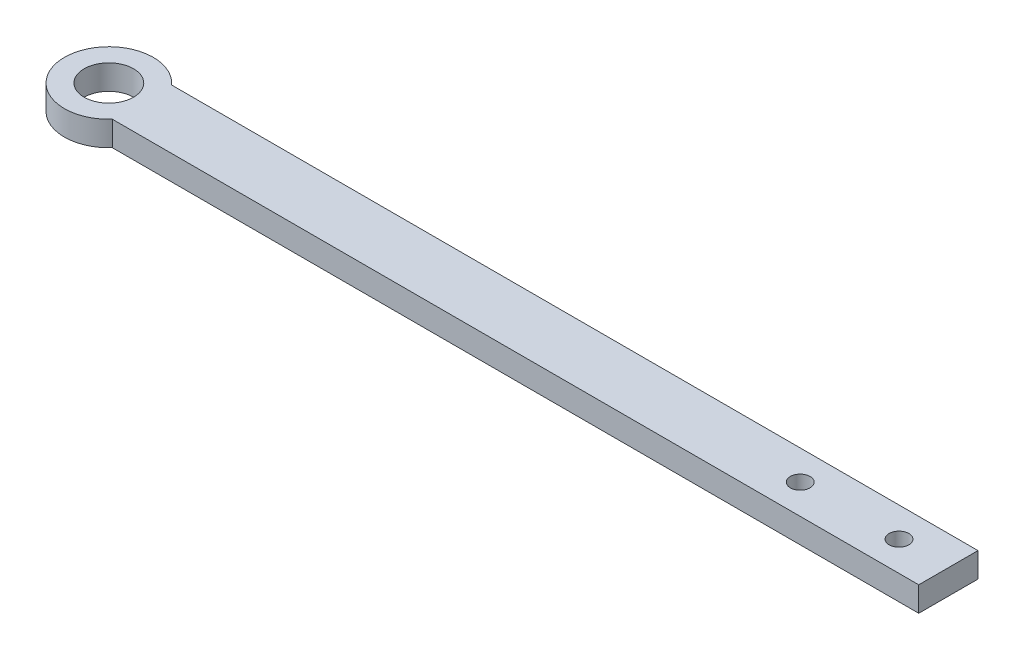
from build123d import *

# Parameters (mm, degrees)
BOSS_EXTRUDE1_DEPTH = 5
SKETCH2_R           = 5
SKETCH2_R_2         = 2
CUT_EXTRUDE1_DEPTH  = 171.311479355


with BuildPart() as part:
    # Sketch1 → Boss-Extrude1 (new body)
    with BuildSketch(Plane(origin=(0, 0, 0), x_dir=(1, 0, 0), z_dir=(0, 1, 0))):
        with BuildLine():
            Line((6.708203932, 6), (170, 6))
            Line((170, 6), (170, -6))
            Line((170, -6), (6.708203932, -6))
            ThreePointArc((6.708203932, -6), (-9, 0), (6.708203932, 6))
        make_face()
    extrude(amount=BOSS_EXTRUDE1_DEPTH)

    # Sketch2 → Cut-Extrude1 (cut, through all)
    with BuildSketch(Plane(origin=(0, 5, 0), x_dir=(1, 0, 0), z_dir=(0, 1, 0))):
        with Locations(Location((0, 0, 0), (0, 0, 270))):
            Circle(SKETCH2_R)
        with Locations(Location((160, 0, 0), (0, 0, 270))):
            Circle(SKETCH2_R_2)
        with Locations(Location((140, 0, 0), (0, 0, 270))):
            Circle(SKETCH2_R_2)
    extrude(amount=-CUT_EXTRUDE1_DEPTH, mode=Mode.SUBTRACT)


solid = part.part
